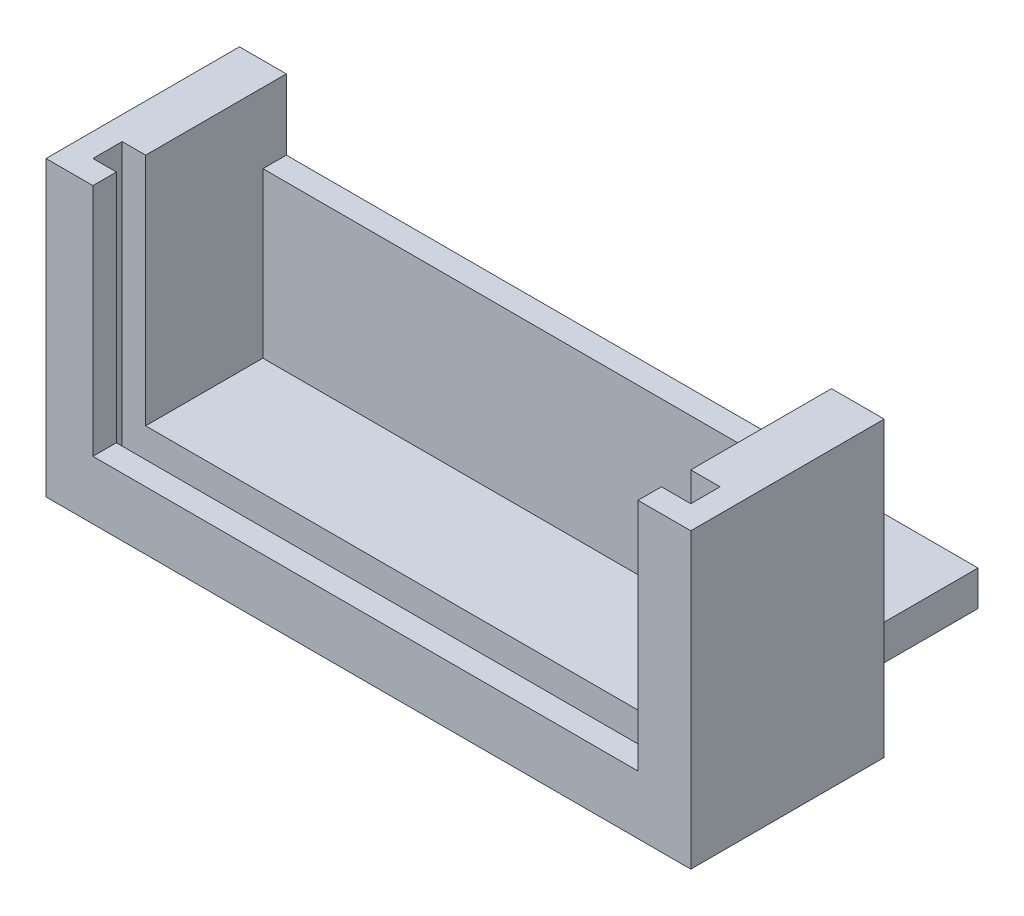
from build123d import *

# Parameters (mm, degrees)
SKETCH1_W           = 55
SKETCH1_H           = 25
BOSS_EXTRUDE1_DEPTH = 16.5
CUT_EXTRUDE1_DEPTH  = 20
SKETCH3_W           = 51
SKETCH3_H           = 2.5
CUT_EXTRUDE2_DEPTH  = 2.5
SKETCH4_W           = 41
SKETCH4_H           = 3
BOSS_EXTRUDE2_DEPTH = 15
SKETCH5_W           = 46.5
SKETCH5_H           = 6
CUT_EXTRUDE3_DEPTH  = 15


with BuildPart() as part:
    # Sketch1 → Boss-Extrude1 (new body)
    with BuildSketch(Plane.XY):
        with Locations((27.5, 12.5)):
            Rectangle(SKETCH1_W, SKETCH1_H)
    extrude(amount=BOSS_EXTRUDE1_DEPTH)

    # Sketch2 → Cut-Extrude1 (cut)
    with BuildSketch(Plane(origin=(0, 25, 0), x_dir=(1, 0, 0), z_dir=(0, 1, 0))):
        Polygon((2, -12), (4, -12), (4, -2), (50.5, -2), (50.5, -12), (53, -12), (53, -14.5), (50.5, -14.5), (50.5, -16.5), (4, -16.5), (4, -14.5), (2, -14.5), align=None)
    extrude(amount=-CUT_EXTRUDE1_DEPTH, mode=Mode.SUBTRACT)

    # Sketch3 → Cut-Extrude2 (cut)
    with BuildSketch(Plane(origin=(0, 5, 0), x_dir=(1, 0, 0), z_dir=(0, 1, 0))):
        with Locations((27.5, -13.25)):
            Rectangle(SKETCH3_W, SKETCH3_H)
    extrude(amount=-CUT_EXTRUDE2_DEPTH, mode=Mode.SUBTRACT)

    # Sketch4 → Boss-Extrude2 (add)
    with BuildSketch(Plane(origin=(0, 0, 0), x_dir=(-1, 0, 0), z_dir=(0, 0, -1))):
        with Locations((-27.5, 1.5)):
            Rectangle(SKETCH4_W, SKETCH4_H)
    extrude(amount=BOSS_EXTRUDE2_DEPTH)

    # Sketch5 → Cut-Extrude3 (cut)
    with BuildSketch(Plane.XY.offset(2)):
        with Locations((27.25, 22)):
            Rectangle(SKETCH5_W, SKETCH5_H)
    extrude(amount=-CUT_EXTRUDE3_DEPTH, mode=Mode.SUBTRACT)


solid = part.part
